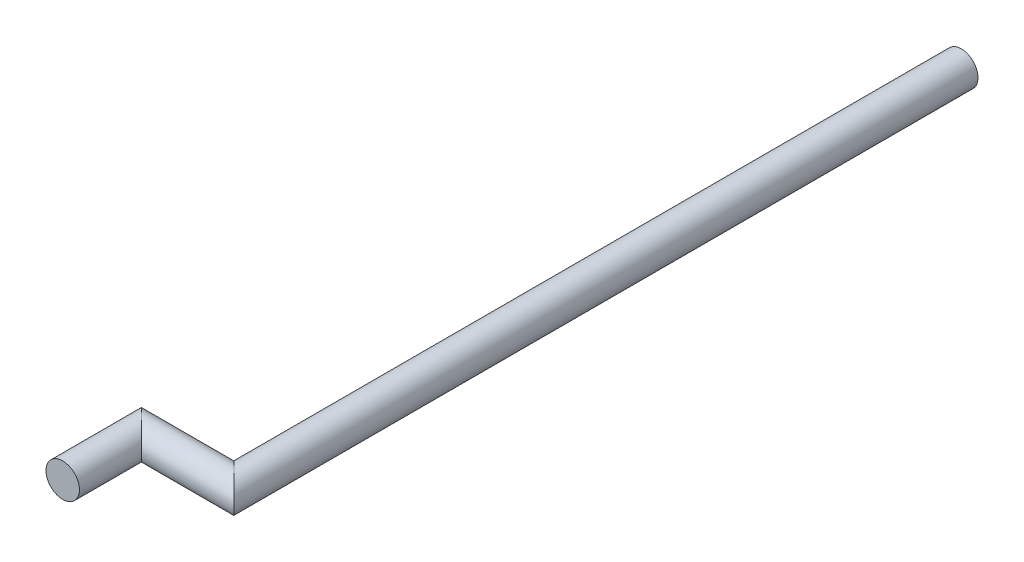
from build123d import *

# Parameters (mm, degrees)
SKETCH1_R = 0.85


with BuildPart() as part:
    # Sweep1: sweep along a path in Sketch2
    with BuildLine(Plane(origin=(0, 0, 0), x_dir=(1, 0, 0), z_dir=(0, 1, 0))) as sweep1_path:
        Line((0, 0), (0, 4))
        Line((0, 4), (4.7, 4))
        Line((4.7, 4), (4.7, 41))
    # Sketch1 → Sweep1 (sweep)
    with BuildSketch(Plane.XY):
        Circle(SKETCH1_R)
    sweep(path=sweep1_path.line, transition=Transition.RIGHT)


solid = part.part
